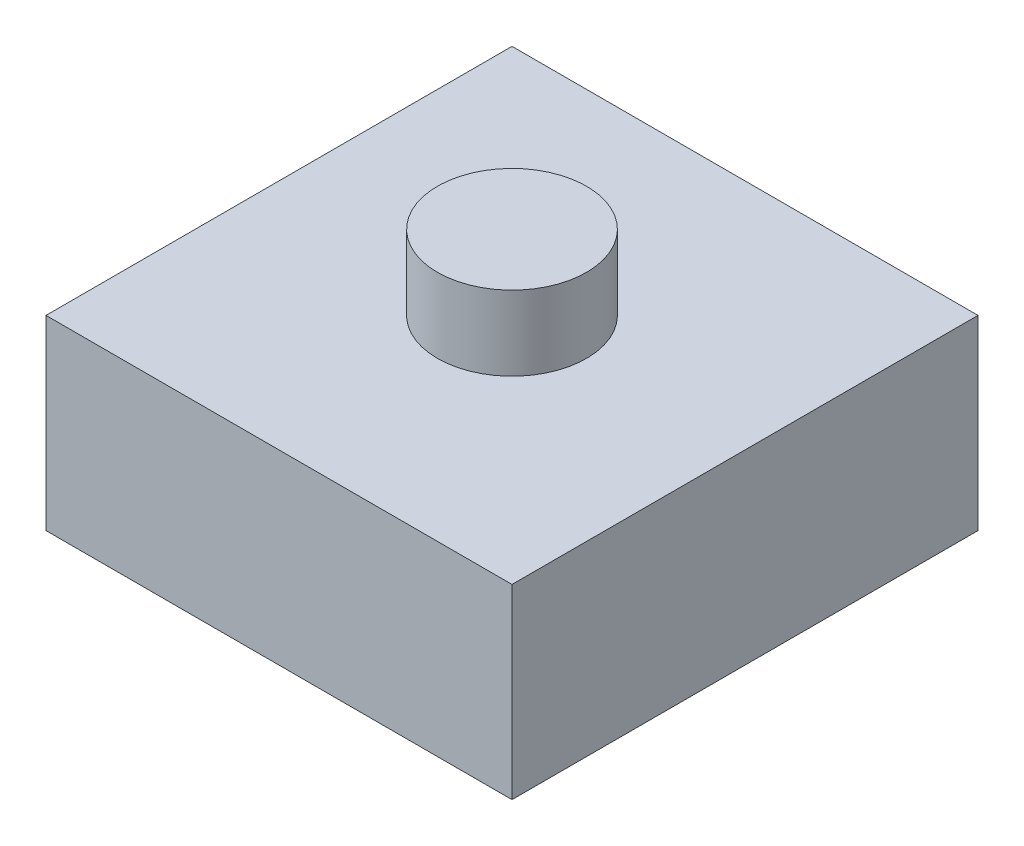
from build123d import *

# Parameters (mm, degrees)
SKETCH1_W           = 25
SKETCH1_H           = 25
BOSS_EXTRUDE1_DEPTH = 10
SKETCH2_R           = 4
BOSS_EXTRUDE2_DEPTH = 4


with BuildPart() as part:
    # Sketch1 → Boss-Extrude1 (new body)
    with BuildSketch(Plane(origin=(0, 0, 0), x_dir=(1, 0, 0), z_dir=(0, 1, 0))):
        Rectangle(SKETCH1_W, SKETCH1_H)
    extrude(amount=BOSS_EXTRUDE1_DEPTH)

    # Sketch2 → Boss-Extrude2 (add)
    with BuildSketch(Plane(origin=(0, 10, 0), x_dir=(1, 0, 0), z_dir=(0, 1, 0))):
        with Locations(Location((0, 0, 0), (0, 0, 270))):
            Circle(SKETCH2_R)
    extrude(amount=BOSS_EXTRUDE2_DEPTH)


solid = part.part
